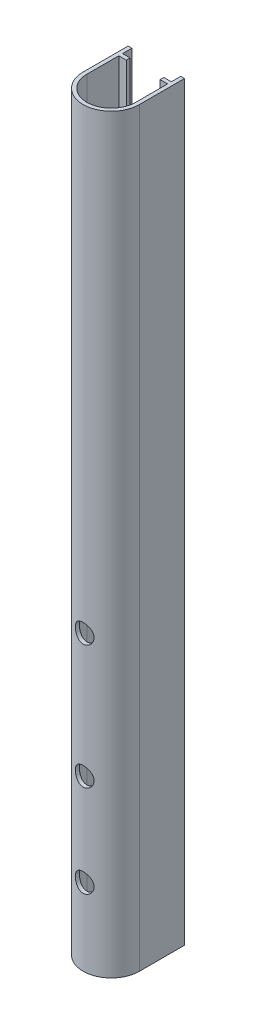
from build123d import *

# Parameters (mm, degrees)
BOSS_EXTRU_1_DEPTH      = 200
ENL_V_MAT_EXTRU_1_DEPTH = 202.088289067
ESQUISSE6_R             = 2.5
ENL_V_MAT_EXTRU_3_DEPTH = 202.088289067


with BuildPart() as part:
    # Esquisse1 → Boss.-Extru.1 (new body)
    with BuildSketch(Plane(origin=(0, 0, 0), x_dir=(1, 0, 0), z_dir=(0, 1, 0))):
        with BuildLine():
            Line((-7.5, 0), (7.5, 0))
            Line((7.5, 0), (7.5, -12))
            ThreePointArc((7.5, -12), (0, -19.5), (-7.5, -12))
            Line((-7.5, -12), (-7.5, 0))
        make_face()
    extrude(amount=BOSS_EXTRU_1_DEPTH)

    # Esquisse2 → Enlèv. mat.-Extru.1 (cut, through all)
    with BuildSketch(Plane(origin=(0, 200, 0), x_dir=(1, 0, 0), z_dir=(0, 1, 0))):
        with BuildLine():
            Line((-6.5, 2.5), (6.5, 2.5))
            Line((6.5, 2.5), (6.5, -2.5))
            Line((6.5, -2.5), (4.5, -2.5))
            Line((4.5, -2.5), (4.5, -3.5))
            Line((4.5, -3.5), (6.5, -3.5))
            Line((6.5, -3.5), (6.5, -12))
            ThreePointArc((6.5, -12), (0, -18.5), (-6.5, -12))
            Line((-6.5, -12), (-6.5, -3.5))
            Line((-6.5, -3.5), (-4.5, -3.5))
            Line((-4.5, -3.5), (-4.5, -2.5))
            Line((-4.5, -2.5), (-6.5, -2.5))
            Line((-6.5, -2.5), (-6.5, 2.5))
        make_face()
    extrude(amount=-ENL_V_MAT_EXTRU_1_DEPTH, mode=Mode.SUBTRACT)

    # Esquisse6 → Enlèv. mat.-Extru.3 (cut, through all)
    with BuildSketch(Plane.XY):
        with Locations(Location((0, 20.5, 0), (0, 0, 180))):
            Circle(ESQUISSE6_R)
        with Locations(Location((0, 45, 0), (0, 0, 180))):
            Circle(ESQUISSE6_R)
        with Locations(Location((0, 78, 0), (0, 0, 180))):
            Circle(ESQUISSE6_R)
    extrude(amount=ENL_V_MAT_EXTRU_3_DEPTH, mode=Mode.SUBTRACT)


solid = part.part
